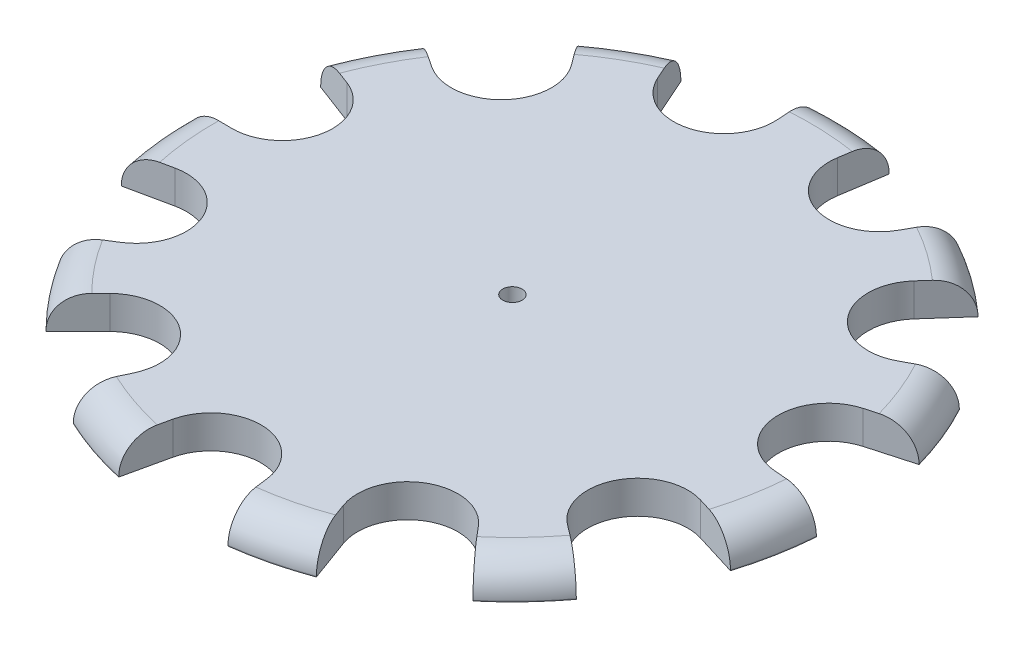
from build123d import *

# Parameters (mm, degrees)
SKETCH1_R           = 51
BOSS_EXTRUDE1_DEPTH = 5.1
CUT_EXTRUDE1_DEPTH  = 5.1
SKETCH4_R           = 1.5
CUT_EXTRUDE2_DEPTH  = 5.1
FILLET1_R           = 5


with BuildPart() as part:
    # Sketch1 → Boss-Extrude1 (new body)
    with BuildSketch(Plane(origin=(0, 0, 0), x_dir=(1, 0, 0), z_dir=(0, 1, 0))):
        Circle(SKETCH1_R)
    extrude(amount=BOSS_EXTRUDE1_DEPTH)

    # Sketch2 → Cut-Extrude1 (cut)
    with BuildSketch(Plane(origin=(0, 5.1, 0), x_dir=(1, 0, 0), z_dir=(0, 1, 0))):
        with BuildLine():
            Line((-11.098432074, -49.777754123), (-9.575117868, -42.945513361))
            ThreePointArc((-9.575117868, -42.945513361), (-1.684423344, -36.881911294), (5.682895314, -43.571675557))
            Line((5.682895314, -43.571675557), (6.595879877, -50.571675557))
            ThreePointArc((6.595879877, -50.571675557), (-2.724355459, -60.718344758), (-11.098432074, -49.777754123))
        make_face()
        with BuildLine():
            Line((17.569213304, -47.8782074), (15.157752655, -41.306688738))
            ThreePointArc((15.157752655, -41.306688738), (18.544356564, -31.925249842), (28.37134792, -33.63133386))
            Line((28.37134792, -33.63133386), (32.884971452, -38.981773338))
            ThreePointArc((32.884971452, -38.981773338), (30.528271006, -52.556295267), (17.569213304, -47.8782074))
        make_face()
        with BuildLine():
            Line((40.661168739, -30.784238772), (35.08022401, -26.558951097))
            ThreePointArc((35.08022401, -26.558951097), (32.858461921, -16.835564085), (42.048323899, -12.959107118))
            Line((42.048323899, -12.959107118), (48.737829974, -15.020783251))
            ThreePointArc((48.737829974, -15.020783251), (54.092576731, -27.715206033), (40.661168739, -30.784238772))
        make_face()
        with BuildLine():
            Line((50.854495391, -3.84971408), (43.874466612, -3.321321951))
            ThreePointArc((43.874466612, -3.321321951), (36.739689022, 3.648285679), (42.364471526, 11.88492963))
            Line((42.364471526, 11.88492963), (49.104273814, 13.775713889))
            ThreePointArc((49.104273814, 13.775713889), (60.481968155, 6.005916331), (50.854495391, -3.84971408))
        make_face()
        with BuildLine():
            Line((33.866271132, 38.132344271), (29.217959408, 32.898493096))
            ThreePointArc((29.217959408, 32.898493096), (28.937891642, 22.928435733), (38.707848174, 20.921340533))
            Line((38.707848174, 20.921340533), (44.86591493, 24.249735618))
            ThreePointArc((44.86591493, 24.249735618), (47.638417399, 37.745472451), (33.866271132, 38.132344271))
        make_face()
        with BuildLine():
            Line((24.63888074, 44.653393554), (21.25707358, 38.524496399))
            ThreePointArc((21.25707358, 38.524496399), (11.952489475, 34.932116071), (6.798961402, 43.471532338))
            Line((6.798961402, 43.471532338), (7.880614352, 50.387457938))
            ThreePointArc((7.880614352, 50.387457938), (19.676543461, 57.506287832), (24.63888074, 44.653393554))
        make_face()
        with BuildLine():
            Line((-3.407442633, 50.886042632), (-2.938707059, 43.886042632))
            ThreePointArc((-2.938707059, 43.886042632), (-8.833707064, 35.848015465), (-17.777725742, 40.248633113))
            Line((-17.777725742, 40.248633113), (-20.606000292, 46.651824744))
            ThreePointArc((-20.606000292, 46.651824744), (-14.529793652, 59.017155127), (-3.407442633, 50.886042632))
        make_face()
        with BuildLine():
            Line((-42.553183341, 28.110969168), (-36.712550333, 24.252600851))
            ThreePointArc((-36.712550333, 24.252600851), (-26.803681951, 25.390497666), (-26.20363462, 35.346421781))
            Line((-26.20363462, 35.346421781), (-30.372394673, 40.969716155))
            ThreePointArc((-30.372394673, 40.969716155), (-44.125017966, 41.798591989), (-42.553183341, 28.110969168))
        make_face()
        with BuildLine():
            Line((-47.698494215, 18.051416831), (-41.151642068, 15.573771383))
            ThreePointArc((-41.151642068, 15.573771383), (-36.274959393, 6.873285887), (-43.996437905, 0.559867529))
            Line((-43.996437905, 0.559867529), (-50.995871208, 0.648937363))
            ThreePointArc((-50.995871208, 0.648937363), (-59.716916425, 11.315007536), (-47.698494215, 18.051416831))
        make_face()
        with BuildLine():
            Line((-49.887204855, -10.595602473), (-43.039941443, -9.141304095))
            ThreePointArc((-43.039941443, -9.141304095), (-34.234171794, -13.825202329), (-37.317805237, -23.310542943))
            Line((-37.317805237, -23.310542943), (-43.254728797, -27.019038412))
            ThreePointArc((-43.254728797, -27.019038412), (-56.357311217, -22.759459027), (-49.887204855, -10.595602473))
        make_face()
        with BuildLine():
            Line((-36.2439268, -35.880046964), (-31.26927018, -30.955334635))
            ThreePointArc((-31.26927018, -30.955334635), (-21.328974726, -30.136183816), (-18.796154457, -39.7832198))
            Line((-18.796154457, -39.7832198), (-21.786451757, -46.112368404))
            ThreePointArc((-21.786451757, -46.112368404), (-35.112392197, -49.611081595), (-36.2439268, -35.880046964))
        make_face()
    extrude(amount=-CUT_EXTRUDE1_DEPTH, mode=Mode.SUBTRACT)

    # Sketch4 → Cut-Extrude2 (cut)
    with BuildSketch(Plane(origin=(0, 5.1, 0), x_dir=(1, 0, 0), z_dir=(0, 1, 0))):
        Circle(SKETCH4_R)
    extrude(amount=-CUT_EXTRUDE2_DEPTH, mode=Mode.SUBTRACT)

    # Fillet1
    fillet1_edges = [part.edges().sort_by_distance(p)[0] for p in [
        (2.250436176, 5.1, -50.950324209),
        (29.433725891, 5.1, -41.649199034),
        (47.276054995, 5.1, -19.130463248),
        (50.108442547, 5.1, 9.49441865),
        (37.000791579, 5.1, 35.099023099),
        (-25.647042282, 5.1, -44.082073706),
        (-45.405285747, 5.1, -23.224125953),
        (-50.753903082, 5.1, 5.004130492),
        (12.157369156, 5.1, 49.529772614),
        (-39.995480102, 5.1, 31.644297613),
        (-16.544263636, 5.1, 48.241966593),
    ]]
    fillet(fillet1_edges, radius=FILLET1_R)


solid = part.part
